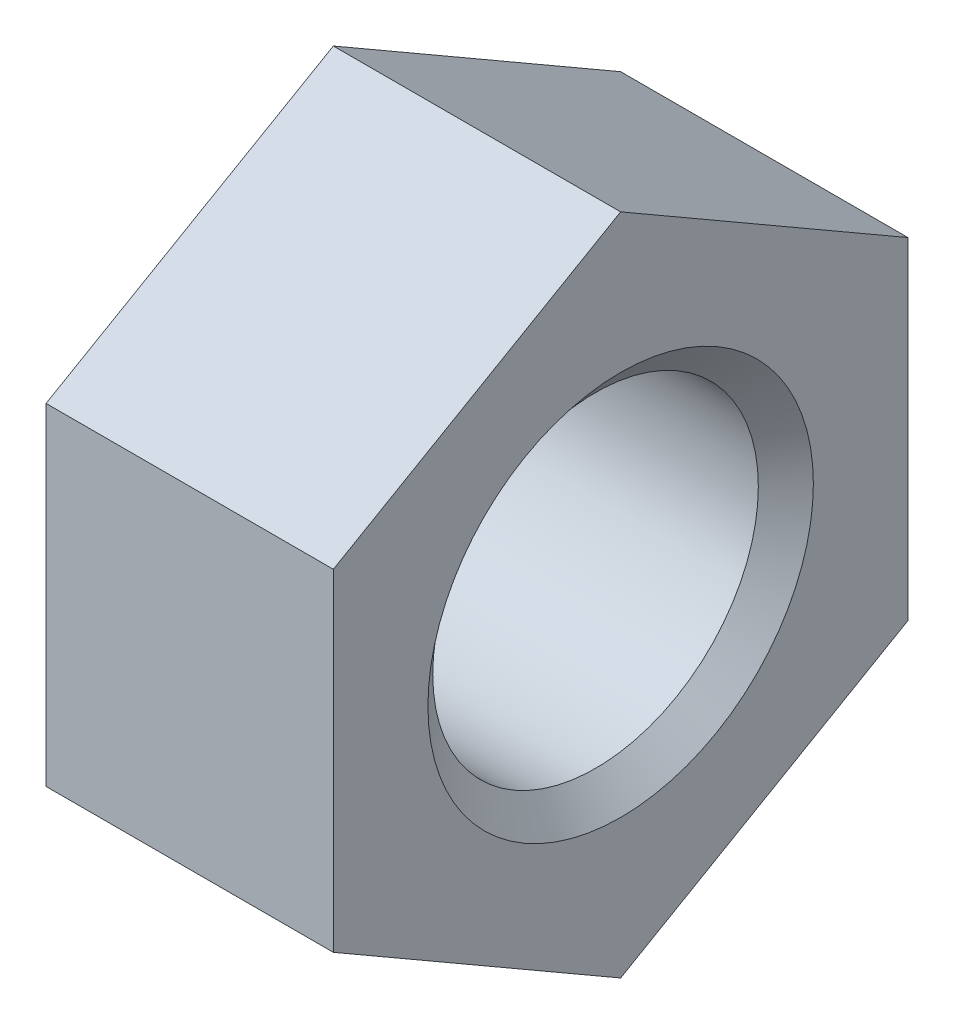
from build123d import *

# Parameters (mm, degrees)
EXTRUDE_1_DEPTH = 6


with BuildPart() as part:
    # 草图2 → 凸台-拉伸1 (new body)
    with BuildSketch(Plane(origin=(0, 0, 0), x_dir=(0, 0, -1), z_dir=(1, 0, 0))):
        Polygon((6, -3.464101615), (6, 3.464101615), (0, 6.92820323), (-6, 3.464101615), (-6, -3.464101615), (0, -6.92820323), align=None)
    extrude(amount=EXTRUDE_1_DEPTH)

    # 草图4 → M8 螺纹孔1 (revolve, cut)
    with BuildSketch(Plane(origin=(6, 0, 0), x_dir=(0, 0, -1), z_dir=(0, 1, 0))):
        Polygon((0, 0), (0, 6), (3.4, 6), (3.4, 0.524437269), (4.025, 0), align=None)
    revolve(axis=Axis((12.35, 0, 0), (-1, 0, 0)), mode=Mode.SUBTRACT)


solid = part.part
